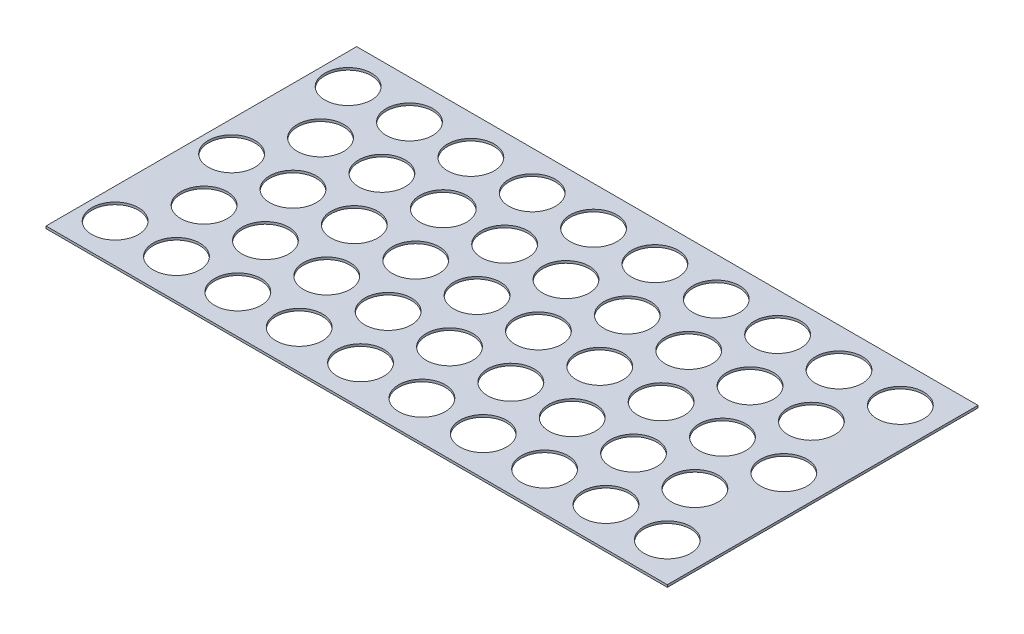
from build123d import *

# Parameters (mm, degrees)
SKETCH1_W               = 203.2
SKETCH1_H               = 101.6
BOSS_EXTRUDE2_DEPTH     = 0.762
CUT_EXTRUDE1_DEPTH      = 118.861900687
CUT_EXTRUDE1_DEPTH_BACK = 118.861900687
SKETCH2_R               = 7.62


with BuildPart() as part:
    # Sketch1 → Boss-Extrude2 (new body)
    with BuildSketch(Plane(origin=(0, 0, 0), x_dir=(1, 0, 0), z_dir=(0, 1, 0))):
        with Locations((1.482009724, 6.339708266)):
            Rectangle(SKETCH1_W, SKETCH1_H)
    extrude(amount=-BOSS_EXTRUDE2_DEPTH)

    # Sketch2 → Cut-Extrude1 (cut, two sides: drawn at the far end of the back side and taken through both)
    with BuildSketch(Plane(origin=(0, 0, 0), x_dir=(1, 0, 0), z_dir=(0, 1, 0)).offset(-CUT_EXTRUDE1_DEPTH_BACK)):
        with Locations(Location((90.382009724, -31.760291734, 0), (0, 0, 270))):
            Circle(SKETCH2_R)
        with Locations(Location((90.382009724, 6.339708266, 0), (0, 0, 270))):
            Circle(SKETCH2_R)
        with Locations(Location((90.382009724, 44.439708266, 0), (0, 0, 270))):
            Circle(SKETCH2_R)
        with Locations(Location((70.316009724, -31.760291734, 0), (0, 0, 270))):
            Circle(SKETCH2_R)
        with Locations(Location((50.250009724, -31.760291734, 0), (0, 0, 270))):
            Circle(SKETCH2_R)
        with Locations(Location((30.184009724, -31.760291734, 0), (0, 0, 270))):
            Circle(SKETCH2_R)
        with Locations(Location((10.118009724, -31.760291734, 0), (0, 0, 270))):
            Circle(SKETCH2_R)
        with Locations(Location((-9.947990276, -31.760291734, 0), (0, 0, 270))):
            Circle(SKETCH2_R)
        with Locations(Location((-30.013990276, -31.760291734, 0), (0, 0, 270))):
            Circle(SKETCH2_R)
        with Locations(Location((-50.079990276, -31.760291734, 0), (0, 0, 270))):
            Circle(SKETCH2_R)
        with Locations(Location((-70.145990276, -31.760291734, 0), (0, 0, 270))):
            Circle(SKETCH2_R)
        with Locations(Location((-90.211990276, -31.760291734, 0), (0, 0, 270))):
            Circle(SKETCH2_R)
        with Locations(Location((70.316009724, 6.339708266, 0), (0, 0, 270))):
            Circle(SKETCH2_R)
        with Locations(Location((50.250009724, 6.339708266, 0), (0, 0, 270))):
            Circle(SKETCH2_R)
        with Locations(Location((30.184009724, 6.339708266, 0), (0, 0, 270))):
            Circle(SKETCH2_R)
        with Locations(Location((10.118009724, 6.339708266, 0), (0, 0, 270))):
            Circle(SKETCH2_R)
        with Locations(Location((-9.947990276, 6.339708266, 0), (0, 0, 270))):
            Circle(SKETCH2_R)
        with Locations(Location((-30.013990276, 6.339708266, 0), (0, 0, 270))):
            Circle(SKETCH2_R)
        with Locations(Location((-50.079990276, 6.339708266, 0), (0, 0, 270))):
            Circle(SKETCH2_R)
        with Locations(Location((-70.145990276, 6.339708266, 0), (0, 0, 270))):
            Circle(SKETCH2_R)
        with Locations(Location((-90.211990276, 6.339708266, 0), (0, 0, 270))):
            Circle(SKETCH2_R)
        with Locations(Location((70.316009724, 44.439708266, 0), (0, 0, 270))):
            Circle(SKETCH2_R)
        with Locations(Location((50.250009724, 44.439708266, 0), (0, 0, 270))):
            Circle(SKETCH2_R)
        with Locations(Location((30.184009724, 44.439708266, 0), (0, 0, 270))):
            Circle(SKETCH2_R)
        with Locations(Location((10.118009724, 44.439708266, 0), (0, 0, 270))):
            Circle(SKETCH2_R)
        with Locations(Location((-9.947990276, 44.439708266, 0), (0, 0, 270))):
            Circle(SKETCH2_R)
        with Locations(Location((-30.013990276, 44.439708266, 0), (0, 0, 270))):
            Circle(SKETCH2_R)
        with Locations(Location((-50.079990276, 44.439708266, 0), (0, 0, 270))):
            Circle(SKETCH2_R)
        with Locations(Location((-70.145990276, 44.439708266, 0), (0, 0, 270))):
            Circle(SKETCH2_R)
        with Locations(Location((-90.211990276, 44.439708266, 0), (0, 0, 270))):
            Circle(SKETCH2_R)
        with Locations(Location((80.349009724, -12.710291734, 0), (0, 0, 270))):
            Circle(SKETCH2_R)
        with Locations(Location((80.349009724, 25.389708266, 0), (0, 0, 270))):
            Circle(SKETCH2_R)
        with Locations(Location((60.283009724, -12.710291734, 0), (0, 0, 270))):
            Circle(SKETCH2_R)
        with Locations(Location((60.283009724, 25.389708266, 0), (0, 0, 270))):
            Circle(SKETCH2_R)
        with Locations(Location((40.217009724, -12.710291734, 0), (0, 0, 270))):
            Circle(SKETCH2_R)
        with Locations(Location((40.217009724, 25.389708266, 0), (0, 0, 270))):
            Circle(SKETCH2_R)
        with Locations(Location((20.151009724, -12.710291734, 0), (0, 0, 270))):
            Circle(SKETCH2_R)
        with Locations(Location((20.151009724, 25.389708266, 0), (0, 0, 270))):
            Circle(SKETCH2_R)
        with Locations(Location((0.085009724, -12.710291734, 0), (0, 0, 270))):
            Circle(SKETCH2_R)
        with Locations(Location((0.085009724, 25.389708266, 0), (0, 0, 270))):
            Circle(SKETCH2_R)
        with Locations(Location((-19.980990276, -12.710291734, 0), (0, 0, 270))):
            Circle(SKETCH2_R)
        with Locations(Location((-19.980990276, 25.389708266, 0), (0, 0, 270))):
            Circle(SKETCH2_R)
        with Locations(Location((-40.046990276, -12.710291734, 0), (0, 0, 270))):
            Circle(SKETCH2_R)
        with Locations(Location((-40.046990276, 25.389708266, 0), (0, 0, 270))):
            Circle(SKETCH2_R)
        with Locations(Location((-60.112990276, -12.710291734, 0), (0, 0, 270))):
            Circle(SKETCH2_R)
        with Locations(Location((-60.112990276, 25.389708266, 0), (0, 0, 270))):
            Circle(SKETCH2_R)
        with Locations(Location((-80.178990276, -12.710291734, 0), (0, 0, 270))):
            Circle(SKETCH2_R)
        with Locations(Location((-80.178990276, 25.389708266, 0), (0, 0, 270))):
            Circle(SKETCH2_R)
    extrude(amount=CUT_EXTRUDE1_DEPTH + CUT_EXTRUDE1_DEPTH_BACK, mode=Mode.SUBTRACT)


solid = part.part
